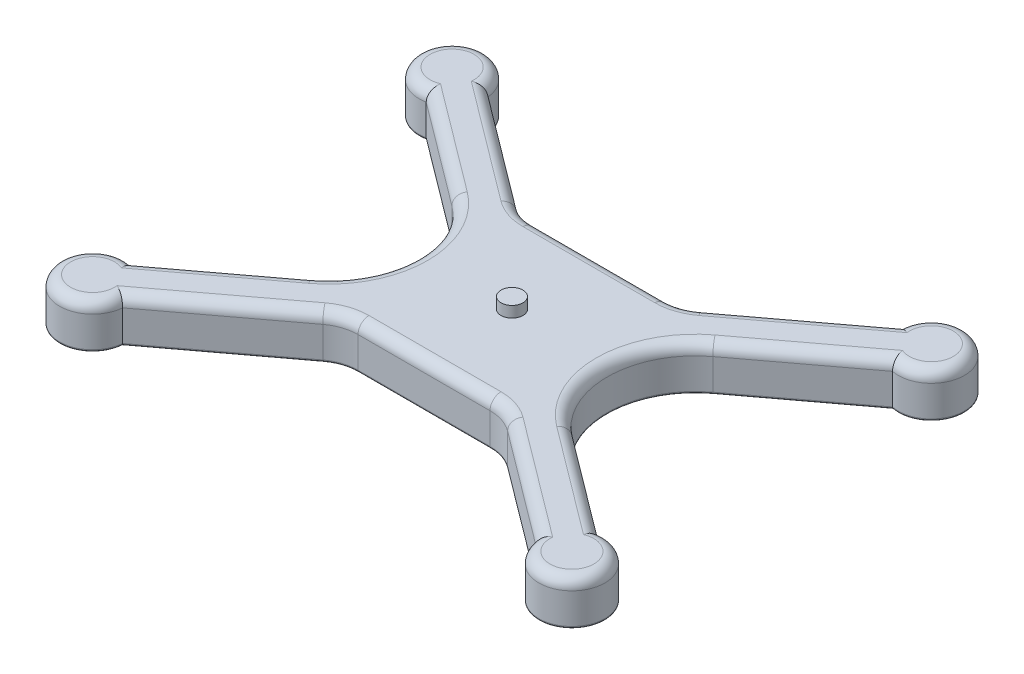
from build123d import *

# Parameters (mm, degrees)
SKETCH1_R           = 7.5
BOSS_EXTRUDE1_DEPTH = 10
FILLET1_R           = 20
SKETCH2_R           = 2.5
BOSS_EXTRUDE2_DEPTH = 2.5
FILLET2_R           = 10
FILLET4_R           = 2.5
FILLET5_R           = 0.5


with BuildPart() as part:
    # Sketch1 → Boss-Extrude1 (new body)
    with BuildSketch(Plane(origin=(0, 0, 0), x_dir=(1, 0, 0), z_dir=(0, 1, 0))):
        Polygon((-18.333333333, 20), (0, 6.25), (18.333333333, 20), align=None)
        with BuildLine():
            Line((-53, 33.5), (-8.333333333, 0))
            Line((-8.333333333, 0), (0, 6.25))
            Line((0, 6.25), (-18.333333333, 20))
            Line((-18.333333333, 20), (-47, 41.5))
            ThreePointArc((-47, 41.5), (-46.979105204, 41.177351357), (-46.972135955, 40.854101966))
            ThreePointArc((-46.972135955, 40.854101966), (-48.671660989, 36.099684003), (-53, 33.5))
        make_face()
        Polygon((-8.333333333, 0), (0, -6.25), (8.333333333, 0), (0, 6.25), align=None)
        with BuildLine():
            Line((0, 6.25), (8.333333333, 0))
            Line((8.333333333, 0), (53, 33.5))
            ThreePointArc((53, 33.5), (48.472135955, 36.354101966), (47, 41.5))
            Line((47, 41.5), (18.333333333, 20))
            Line((18.333333333, 20), (0, 6.25))
        make_face()
        with BuildLine():
            Line((0, -6.25), (18.333333333, -20))
            Line((18.333333333, -20), (47, -41.5))
            ThreePointArc((47, -41.5), (48.472135955, -36.354101966), (53, -33.5))
            Line((53, -33.5), (8.333333333, 0))
            Line((8.333333333, 0), (0, -6.25))
        make_face()
        Polygon((-18.333333333, -20), (18.333333333, -20), (0, -6.25), align=None)
        with BuildLine():
            Line((-18.333333333, -20), (0, -6.25))
            Line((0, -6.25), (-8.333333333, 0))
            Line((-8.333333333, 0), (-53, -33.5))
            ThreePointArc((-53, -33.5), (-48.671660989, -36.099684003), (-46.972135955, -40.854101966))
            ThreePointArc((-46.972135955, -40.854101966), (-46.979105204, -41.177351357), (-47, -41.5))
            Line((-47, -41.5), (-18.333333333, -20))
        make_face()
        with Locations((-54.472135955, 40.854101966)):
            Circle(SKETCH1_R)
        with Locations((-54.472135955, -40.854101966)):
            Circle(SKETCH1_R)
        with Locations((54.472135955, -40.854101966)):
            Circle(SKETCH1_R)
        with Locations((54.472135955, 40.854101966)):
            Circle(SKETCH1_R)
    extrude(amount=BOSS_EXTRUDE1_DEPTH)

    # Fillet1
    fillet1_edges = [part.edges().sort_by_distance(p)[0] for p in [
        (8.333333333, 5, 0),
        (-8.333333333, 5, 0),
    ]]
    fillet(fillet1_edges, radius=FILLET1_R)

    # Sketch2 → Boss-Extrude2 (add)
    with BuildSketch(Plane(origin=(0, 10, 0), x_dir=(1, 0, 0), z_dir=(0, 1, 0))):
        with Locations(Location((0, 0, 0), (0, 0, 270))):
            Circle(SKETCH2_R)
    extrude(amount=BOSS_EXTRUDE2_DEPTH)

    # Fillet2
    fillet2_edges = [part.edges().sort_by_distance(p)[0] for p in [
        (18.333333333, 5, -20),
        (18.333333333, 5, 20),
        (-18.333333333, 5, 20),
        (-18.333333333, 5, -20),
    ]]
    fillet(fillet2_edges, radius=FILLET2_R)

    # Fillet4
    fillet4_edges = [part.edges().sort_by_distance(p)[0] for p in [
        (-34, 10, -31.75),
        (-60.472135955, 10, -45.354101966),
        (-41.333333333, 10, -24.75),
        (-41.333333333, 10, 24.75),
        (-60.472135955, 10, 45.354101966),
        (-34, 10, 31.75),
        (41.333333333, 10, -24.75),
        (41.333333333, 10, 24.75),
        (60.472135955, 10, 45.354101966),
        (21.666666667, 10, 0),
        (-21.666666667, 10, 0),
        (60.472135955, 10, -45.354101966),
        (34, 10, 31.75),
        (0, 10, 20),
        (0, 10, -20),
        (34, 10, -31.75),
        (18.16227766, 10, 20.513167019),
        (-18.16227766, 10, 20.513167019),
        (18.16227766, 10, -20.513167019),
        (-18.16227766, 10, -20.513167019),
    ]]
    fillet(fillet4_edges, radius=FILLET4_R)

    # Fillet5
    fillet5_edges = [part.edges().sort_by_distance(p)[0] for p in [
        (60.472135955, 0, -45.354101966),
        (60.472135955, 0, 45.354101966),
        (-34, 0, 31.75),
        (-60.472135955, 0, 45.354101966),
        (-41.333333333, 0, 24.75),
        (-41.333333333, 0, -24.75),
        (-60.472135955, 0, -45.354101966),
        (-34, 0, -31.75),
        (41.333333333, 0, -24.75),
        (41.333333333, 0, 24.75),
        (21.666666667, 0, 0),
        (-21.666666667, 0, 0),
        (34, 0, 31.75),
        (0, 0, 20),
        (0, 0, -20),
        (34, 0, -31.75),
        (18.16227766, 0, 20.513167019),
        (-18.16227766, 0, 20.513167019),
        (18.16227766, 0, -20.513167019),
        (-18.16227766, 0, -20.513167019),
    ]]
    fillet(fillet5_edges, radius=FILLET5_R)


solid = part.part
